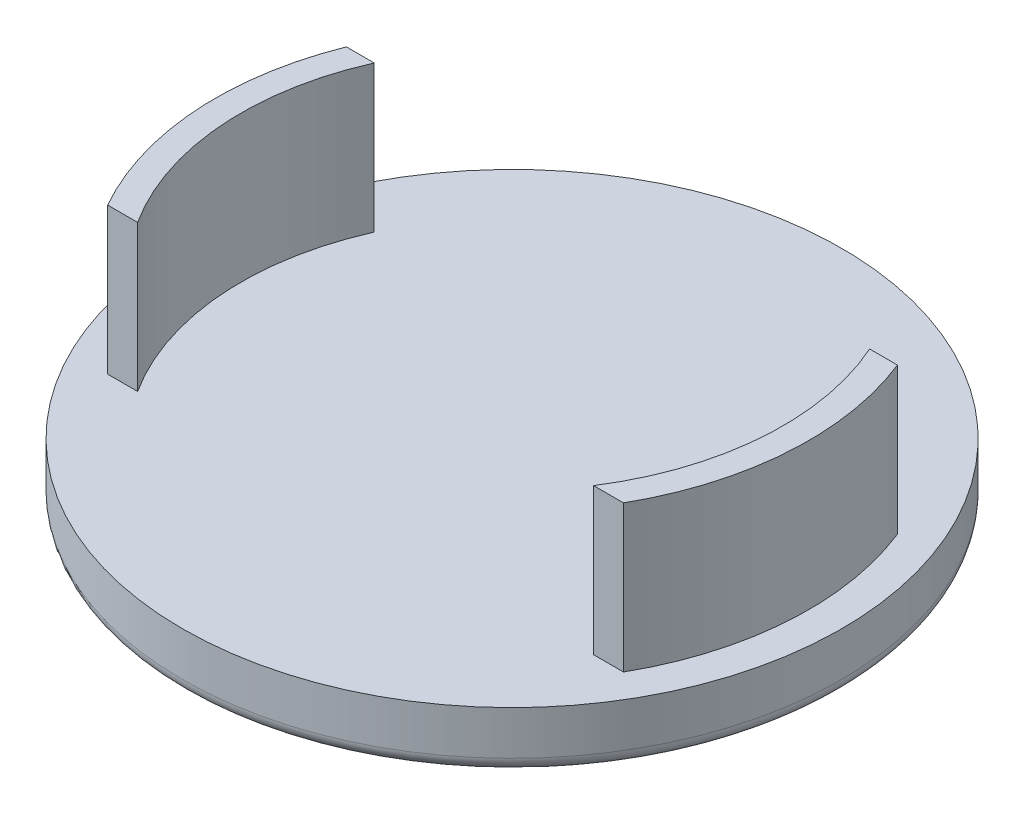
from build123d import *

# Parameters (mm, degrees)
SKETCH1_R           = 22.5
SKETCH1_R_2         = 20.25
SKETCH1_R_3         = 18.5
BOSS_EXTRUDE1_DEPTH = 4
SKETCH2_R           = 20.25
SKETCH2_R_2         = 18.5
BOSS_EXTRUDE2_DEPTH = 10
SKETCH3_W           = 46.515228405
SKETCH3_H           = 15.633520553
SKETCH3_W_2         = 41.010467647
SKETCH3_H_2         = 11.670092807
CUT_EXTRUDE1_DEPTH  = 10
FILLET1_R           = 1


with BuildPart() as part:
    # Sketch1 → Boss-Extrude1 (new body)
    # profile 1 of 3: a face of its own
    with BuildSketch(Plane(origin=(0, 0, 0), x_dir=(1, 0, 0), z_dir=(0, 1, 0))):
        with Locations(Location((0, 0, 0), (0, 0, 270))):
            Circle(SKETCH1_R)
        Circle(SKETCH1_R_2, mode=Mode.SUBTRACT)
    # profile 2 of 3: a face of its own
    with BuildSketch(Plane(origin=(0, 0, 0), x_dir=(1, 0, 0), z_dir=(0, 1, 0))):
        Circle(SKETCH1_R_2)
        Circle(SKETCH1_R_3, mode=Mode.SUBTRACT)
    # profile 3 of 3: a face of its own
    with BuildSketch(Plane(origin=(0, 0, 0), x_dir=(1, 0, 0), z_dir=(0, 1, 0))):
        Circle(SKETCH1_R_3)
    extrude(amount=BOSS_EXTRUDE1_DEPTH)

    # Sketch2 → Boss-Extrude2 (add)
    with BuildSketch(Plane(origin=(0, 4, 0), x_dir=(1, 0, 0), z_dir=(0, 1, 0))):
        with Locations(Location((0, 0, 0), (0, 0, 270))):
            Circle(SKETCH2_R)
        with Locations(Location((0, 0, 0), (0, 0, 270))):
            Circle(SKETCH2_R_2, mode=Mode.SUBTRACT)
    extrude(amount=BOSS_EXTRUDE2_DEPTH)

    # Sketch3 → Cut-Extrude1 (cut)
    with BuildSketch(Plane(origin=(0, 14, 0), x_dir=(1, 0, 0), z_dir=(0, 1, 0))):
        with Locations((-0.927501078, 15.316760277)):
            Rectangle(SKETCH3_W, SKETCH3_H)
        with Locations((-0.707310647, -15.835046403)):
            Rectangle(SKETCH3_W_2, SKETCH3_H_2)
    extrude(amount=-CUT_EXTRUDE1_DEPTH, mode=Mode.SUBTRACT)

    # Fillet1
    fillet1_edges = [part.edges().sort_by_distance(p)[0] for p in [
        (0, 0, -22.5),
    ]]
    fillet(fillet1_edges, radius=FILLET1_R)


solid = part.part
